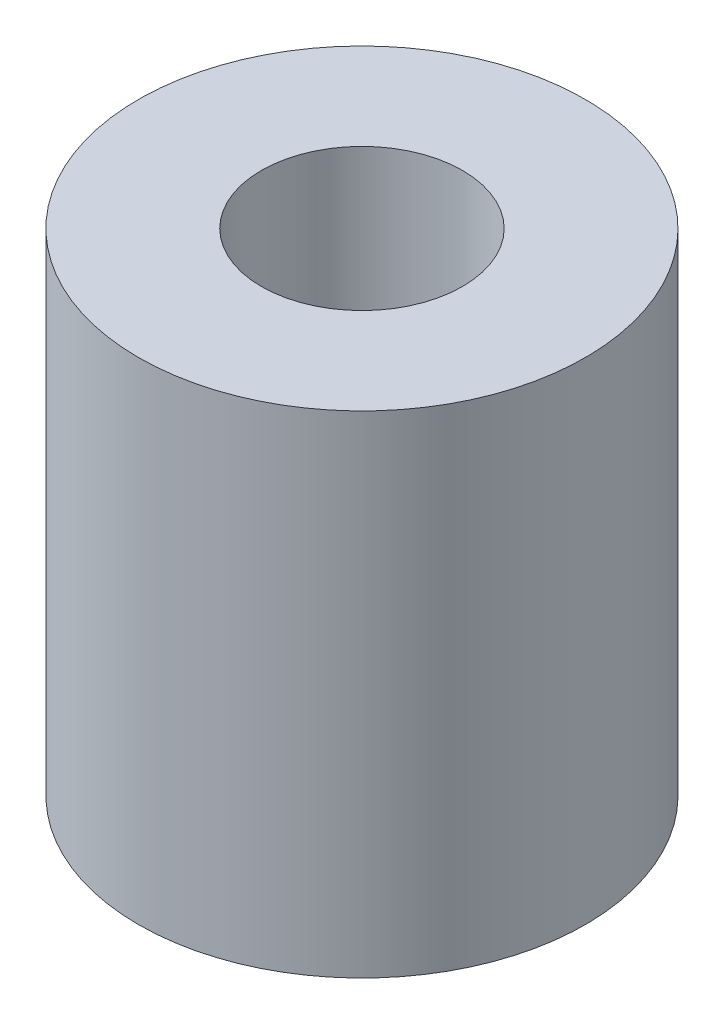
from build123d import *

# Parameters (mm, degrees)
SKETCH1_R           = 10
BOSS_EXTRUDE1_DEPTH = 21.976
SKETCH2_R           = 4.5
CUT_EXTRUDE1_DEPTH  = 27.133208299


with BuildPart() as part:
    # Sketch1 → Boss-Extrude1 (new body)
    with BuildSketch(Plane(origin=(0, 0, 0), x_dir=(1, 0, 0), z_dir=(0, 1, 0))):
        with Locations(Location((0, 0, 0), (0, 0, 270))):
            Circle(SKETCH1_R)
    extrude(amount=BOSS_EXTRUDE1_DEPTH)

    # Sketch2 → Cut-Extrude1 (cut, through all)
    with BuildSketch(Plane(origin=(0, 21.976, 0), x_dir=(1, 0, 0), z_dir=(0, 1, 0))):
        with Locations(Location((0, 0, 0), (0, 0, 270))):
            Circle(SKETCH2_R)
    extrude(amount=-CUT_EXTRUDE1_DEPTH, mode=Mode.SUBTRACT)


solid = part.part
